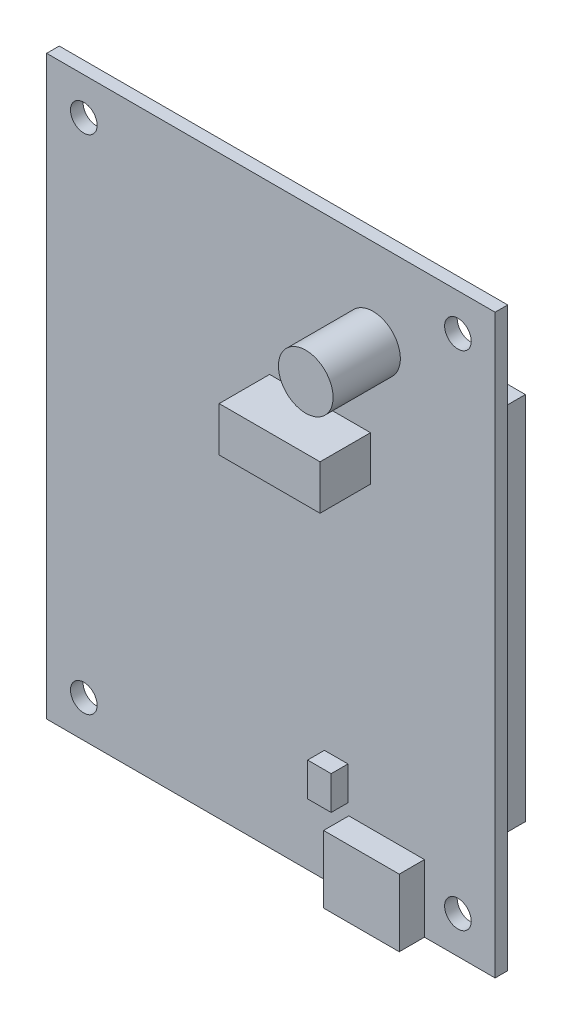
from build123d import *

# Parameters (mm, degrees)
SKETCH_1_W      = 53.34
SKETCH_1_H      = 68.58
SKETCH_1_R      = 1.585
EXTRUDE_1_DEPTH = 1.5
SKETCH_2_R      = 3.25
EXTRUDE_2_DEPTH = 8
SKETCH_3_W      = 12
SKETCH_3_H      = 5.3
EXTRUDE_3_DEPTH = 6
SKETCH_4_W      = 2.8
SKETCH_4_H      = 4
EXTRUDE_4_DEPTH = 2
SKETCH_5_W      = 4.8
SKETCH_5_H      = 44
EXTRUDE_5_DEPTH = 4
SKETCH_6_W      = 9
SKETCH_6_H      = 8
EXTRUDE_6_DEPTH = 3


with BuildPart() as part:
    # 草图1 → 凸台-拉伸1 (new body)
    with BuildSketch(Plane.XY):
        with Locations((26.67, 34.29)):
            Rectangle(SKETCH_1_W, SKETCH_1_H)
        with Locations((48.92, 64.16)):
            Circle(SKETCH_1_R, mode=Mode.SUBTRACT)
        with Locations((4.42, 64.16)):
            Circle(SKETCH_1_R, mode=Mode.SUBTRACT)
        with Locations((4.42, 4.42)):
            Circle(SKETCH_1_R, mode=Mode.SUBTRACT)
        with Locations((48.92, 4.42)):
            Circle(SKETCH_1_R, mode=Mode.SUBTRACT)
    extrude(amount=EXTRUDE_1_DEPTH)

    # 草图2 → 凸台-拉伸2 (add)
    with BuildSketch(Plane.XY.offset(1.5)):
        with Locations(Location((38.82, 58.16, 0), (0, 0, 180))):
            Circle(SKETCH_2_R)
    extrude(amount=EXTRUDE_2_DEPTH)

    # 草图3 → 凸台-拉伸3 (add)
    with BuildSketch(Plane.XY.offset(1.5)):
        with Locations((32.52, 46.11)):
            Rectangle(SKETCH_3_W, SKETCH_3_H)
    extrude(amount=EXTRUDE_3_DEPTH)

    # 草图4 → 凸台-拉伸4 (add)
    with BuildSketch(Plane.XY.offset(1.5)):
        with Locations((34.44, 11.3)):
            Rectangle(SKETCH_4_W, SKETCH_4_H)
    extrude(amount=EXTRUDE_4_DEPTH)

    # 草图5 → 凸台-拉伸5 (add)
    with BuildSketch(Plane(origin=(0, 0, 0), x_dir=(-1, 0, 0), z_dir=(0, 0, -1))):
        with Locations((-49.04, 34.4)):
            Rectangle(SKETCH_5_W, SKETCH_5_H)
        with Locations((-4.3, 34.4)):
            Rectangle(SKETCH_5_W, SKETCH_5_H)
    extrude(amount=EXTRUDE_5_DEPTH)

    # 草图6 → 凸台-拉伸6 (add)
    with BuildSketch(Plane.XY.offset(1.5)):
        with Locations((40.44, 4)):
            Rectangle(SKETCH_6_W, SKETCH_6_H)
    extrude(amount=EXTRUDE_6_DEPTH)


solid = part.part
